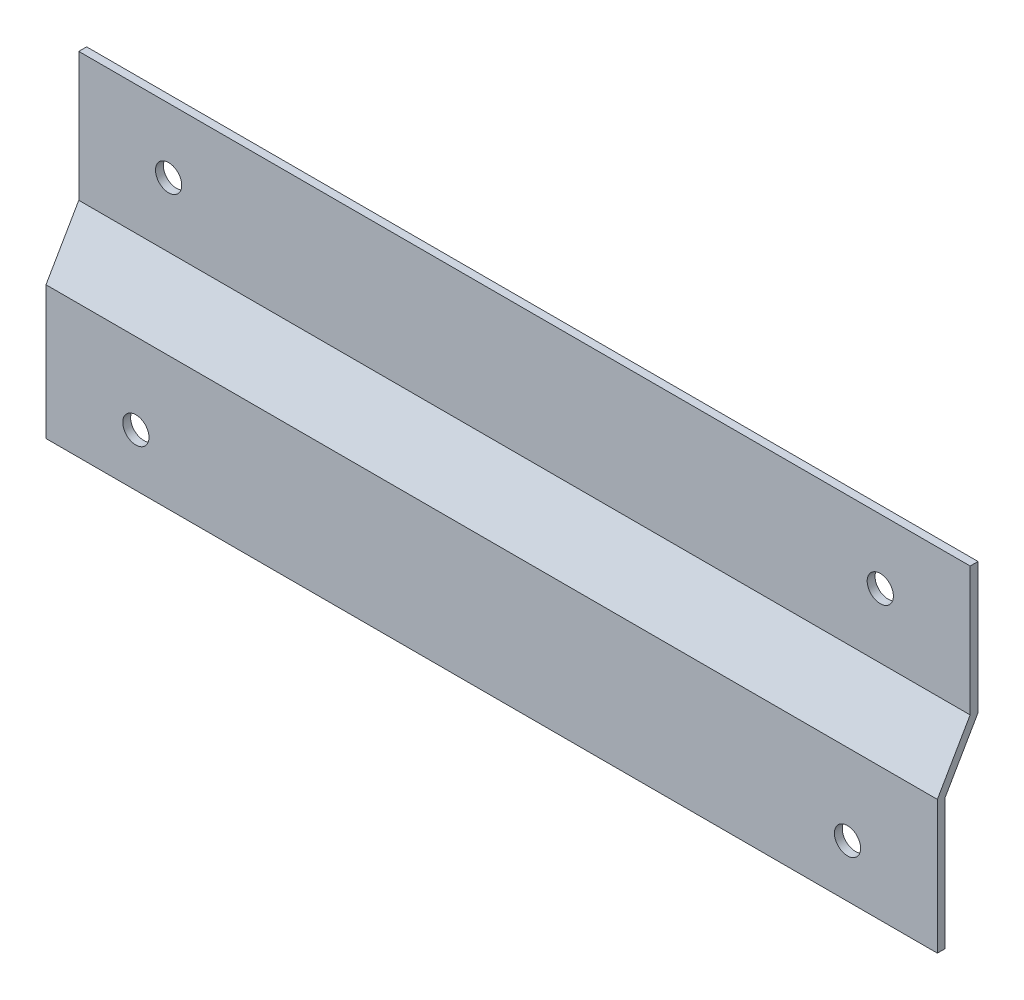
from build123d import *

# Parameters (mm, degrees)
WYCI_GNI_CIE_CIENKA_CIANKA2_DEPTH      = 170
WYCI_GNI_CIE_CIENKA_CIANKA2_DEPTH_BACK = 170
WYTNIJ_WYCI_GNI_CIE2_START             = -10
SZKIC3_R                               = 5
WYTNIJ_WYCI_GNI_CIE2_DEPTH             = 50


with BuildPart() as part:
    # Szkic2 → Wyciągnięcie-cienka ścianka2 (new, two sides: drawn at the far end of the back side and taken through both)
    with BuildSketch(Plane(origin=(0, 0, 0), x_dir=(0, 0, -1), z_dir=(1, 0, 0)).offset(-WYCI_GNI_CIE_CIENKA_CIANKA2_DEPTH_BACK)):
        Polygon((0, 50), (0, 0), (-12.5, -21.650635095), (-12.5, -71.650635095), (-15.5, -71.650635095), (-15.5, -20.846787517), (-3, 0.803847577), (-3, 50), align=None)
    extrude(amount=WYCI_GNI_CIE_CIENKA_CIANKA2_DEPTH + WYCI_GNI_CIE_CIENKA_CIANKA2_DEPTH_BACK)

    # Szkic3 → Wytnij-wyciągnięcie2 (cut)
    with BuildSketch(Plane.XY.offset(3).offset(WYTNIJ_WYCI_GNI_CIE2_START)):
        with Locations(Location((-135.725, 25.401923789, 0), (0, 0, 270))):
            Circle(SZKIC3_R)
        with Locations(Location((-135.725, -51.650635095, 0), (0, 0, 270))):
            Circle(SZKIC3_R)
    wytnij_wyci_gni_cie2 = extrude(amount=WYTNIJ_WYCI_GNI_CIE2_DEPTH, mode=Mode.SUBTRACT)

    # Lustro1: Wytnij-wyciągnięcie2 across plane
    add(wytnij_wyci_gni_cie2.mirror(Plane(origin=(0, 0, 0), x_dir=(0, 0, 1), z_dir=(1, 0, 0))), mode=Mode.SUBTRACT)


solid = part.part
